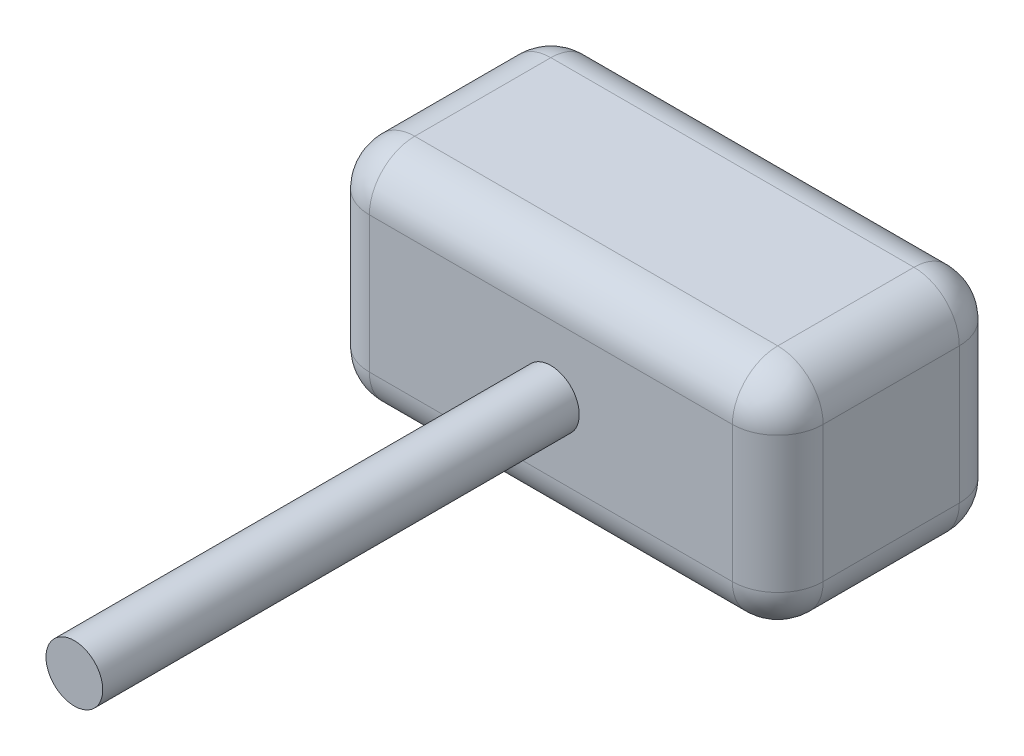
from build123d import *

# Parameters (mm, degrees)
SKETCH5_W               = 20
SKETCH5_H               = 10
BOSS_EXTRUDE2_DEPTH     = 5
CUT_EXTRUDE2_DEPTH      = 13.247448714
CUT_EXTRUDE2_DEPTH_BACK = 13.247448714
SKETCH6_R               = 1.25
FILLET3_R               = 2
SKETCH7_W               = 1.25
SKETCH7_H               = 31


with BuildPart() as part:
    # Sketch5 → Boss-Extrude2 (new, symmetric)
    with BuildSketch(Plane.XY):
        Rectangle(SKETCH5_W, SKETCH5_H)
    extrude(amount=BOSS_EXTRUDE2_DEPTH, both=True)

    # Sketch6 → Cut-Extrude2 (cut, two sides: drawn at the far end of the back side and taken through both)
    with BuildSketch(Plane.XY.offset(-CUT_EXTRUDE2_DEPTH_BACK)):
        Circle(SKETCH6_R)
    extrude(amount=CUT_EXTRUDE2_DEPTH + CUT_EXTRUDE2_DEPTH_BACK, mode=Mode.SUBTRACT)

    # Fillet3
    fillet3_edges = [part.edges().sort_by_distance(p)[0] for p in [
        (10, 0, 5),
        (0, 5, 5),
        (-10, 0, 5),
        (0, 5, -5),
        (10, 0, -5),
        (0, -5, -5),
        (-10, 0, -5),
        (-10, 5, 0),
        (10, 5, 0),
        (10, -5, 0),
        (-10, -5, 0),
        (0, -5, 5),
    ]]
    fillet(fillet3_edges, radius=FILLET3_R)

    # Sketch7 → Revolve1 (revolve)
    with BuildSketch(Plane(origin=(0, 0, 0), x_dir=(1, 0, 0), z_dir=(0, 1, 0)), mode=Mode.PRIVATE) as revolve1_sk:
        with Locations((0.625, -10.5)):
            Rectangle(SKETCH7_W, SKETCH7_H)
    revolve(revolve1_sk.sketch.rotate(Axis((0, 0, -5), (0, 0, 1)), 180), axis=Axis((0, 0, -5), (0, 0, 1)))


solid = part.part
